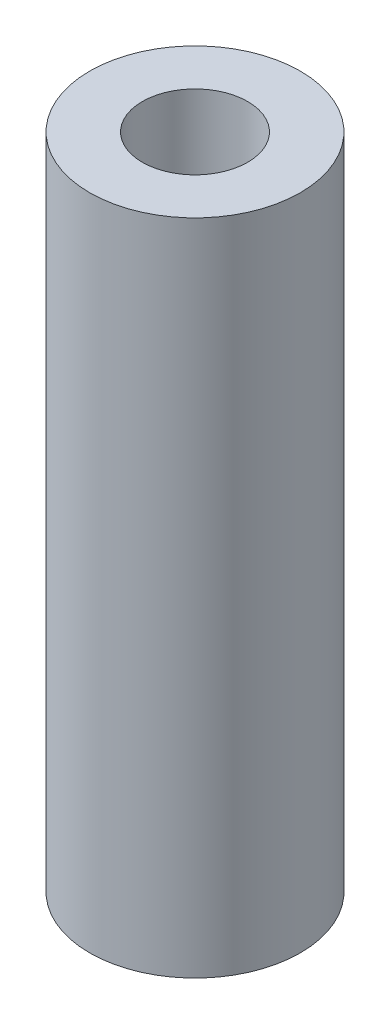
from build123d import *

# Parameters (mm, degrees)
ESQUISSE1_R        = 8
ESQUISSE1_R_2      = 4
BOSS_EXTRU_1_DEPTH = 30
BOSS_EXTRU_2_START = 20
ESQUISSE3_R        = 8
ESQUISSE3_R_2      = 4
BOSS_EXTRU_2_DEPTH = 20


with BuildPart() as part:
    # Esquisse1 → Boss.-Extru.1 (new body)
    with BuildSketch(Plane(origin=(0, 0, 0), x_dir=(1, 0, 0), z_dir=(0, 1, 0))):
        with Locations(Location((0, 0, 0), (0, 0, 270))):
            Circle(ESQUISSE1_R)
        with Locations(Location((0, 0, 0), (0, 0, 270))):
            Circle(ESQUISSE1_R_2, mode=Mode.SUBTRACT)
    extrude(amount=BOSS_EXTRU_1_DEPTH)

    # Esquisse3 → Boss.-Extru.2 (add)
    with BuildSketch(Plane.XZ.offset(BOSS_EXTRU_2_START)):
        with Locations(Location((0, 0, 0), (0, 0, 270))):
            Circle(ESQUISSE3_R)
        with Locations(Location((0, 0, 0), (0, 0, 270))):
            Circle(ESQUISSE3_R_2, mode=Mode.SUBTRACT)
    extrude(amount=-BOSS_EXTRU_2_DEPTH)


solid = part.part
